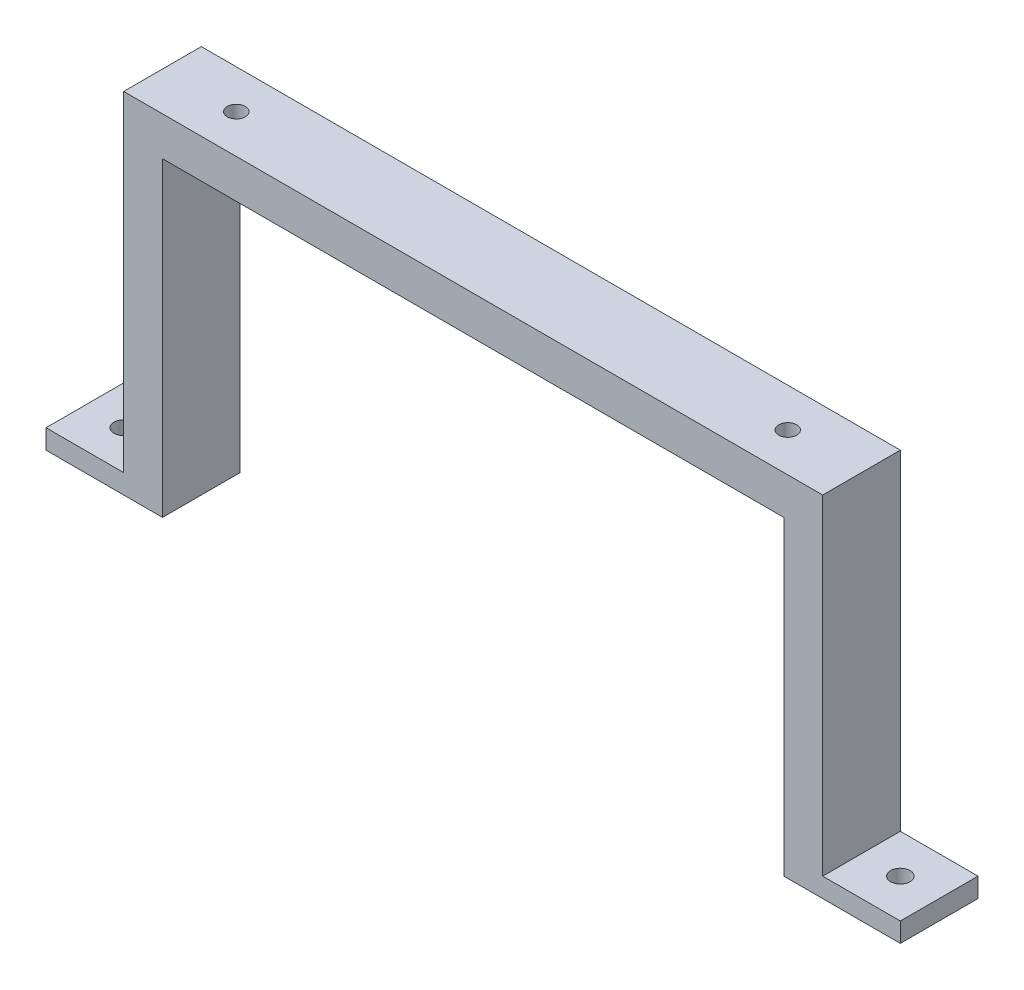
from build123d import *

# Parameters (mm, degrees)
SKETCH1_W           = 114.3
SKETCH1_H           = 12.7
BOSS_EXTRUDE1_DEPTH = 6.35
SKETCH2_W           = 6.35
SKETCH2_H           = 12.7
BOSS_EXTRUDE2_DEPTH = 50.8
SKETCH3_W           = 12.7
SKETCH3_H           = 3.175
BOSS_EXTRUDE3_DEPTH = 12.7
CUT_EXTRUDE1_REACH  = 90.502
SKETCH4_R           = 1.5875
CUT_EXTRUDE2_REACH  = 92.474
SKETCH5_R           = 1.4732


with BuildPart() as part:
    # Sketch1 → Boss-Extrude1 (new body)
    with BuildSketch(Plane(origin=(0, 0, 0), x_dir=(1, 0, 0), z_dir=(0, 1, 0))):
        Rectangle(SKETCH1_W, SKETCH1_H)
    extrude(amount=BOSS_EXTRUDE1_DEPTH)

    # Sketch2 → Boss-Extrude2 (add)
    with BuildSketch(Plane.XZ):
        with Locations((-53.975, 0)):
            Rectangle(SKETCH2_W, SKETCH2_H)
    boss_extrude2 = extrude(amount=BOSS_EXTRUDE2_DEPTH)

    # Sketch3 → Boss-Extrude3 (add)
    with BuildSketch(Plane.ZY.offset(57.15)):
        with Locations((0, -49.2125)):
            Rectangle(SKETCH3_W, SKETCH3_H)
    boss_extrude3 = extrude(amount=BOSS_EXTRUDE3_DEPTH)

    # Mirror1: Boss-Extrude2, Boss-Extrude3 across plane
    add(boss_extrude2.mirror(Plane(origin=(0, 0, 0), x_dir=(0, 0, 1), z_dir=(1, 0, 0))))
    add(boss_extrude3.mirror(Plane(origin=(0, 0, 0), x_dir=(0, 0, 1), z_dir=(1, 0, 0))))

    # Sketch4 → Cut-Extrude1 (cut, up to next)
    with BuildSketch(Plane(origin=(0, -47.625, 0), x_dir=(1, 0, 0), z_dir=(0, 1, 0)), mode=Mode.PRIVATE) as cut_extrude1_sk1:
        with Locations(Location((-63.5, 0, 0), (0, 0, 270))):
            Circle(SKETCH4_R)
    cut_extrude1_tool1 = extrude(cut_extrude1_sk1.sketch, amount=-CUT_EXTRUDE1_REACH, mode=Mode.PRIVATE) & part.part
    cut_extrude1 = cut_extrude1_tool1.solids().sort_by_distance((-63.5, -47.625, 0))[0]
    add(cut_extrude1, mode=Mode.SUBTRACT)

    # Mirror2: Cut-Extrude1 across plane
    add(cut_extrude1.mirror(Plane(origin=(0, 0, 0), x_dir=(0, 0, 1), z_dir=(1, 0, 0))), mode=Mode.SUBTRACT)

    # Sketch5 → Cut-Extrude2 (cut, up to next)
    with BuildSketch(Plane(origin=(0, 6.35, 0), x_dir=(1, 0, 0), z_dir=(0, 1, 0)), mode=Mode.PRIVATE) as cut_extrude2_sk1:
        with Locations(Location((-45.085, 0, 0), (0, 0, 270))):
            Circle(SKETCH5_R)
    cut_extrude2_tool1 = extrude(cut_extrude2_sk1.sketch, amount=-CUT_EXTRUDE2_REACH, mode=Mode.PRIVATE) & part.part
    # Sketch5 → Cut-Extrude2 (cut, up to next)
    with BuildSketch(Plane(origin=(0, 6.35, 0), x_dir=(1, 0, 0), z_dir=(0, 1, 0)), mode=Mode.PRIVATE) as cut_extrude2_sk2:
        with Locations(Location((45.085, 0, 0), (0, 0, 270))):
            Circle(SKETCH5_R)
    cut_extrude2_tool2 = extrude(cut_extrude2_sk2.sketch, amount=-CUT_EXTRUDE2_REACH, mode=Mode.PRIVATE) & part.part
    add(cut_extrude2_tool1.solids().sort_by_distance((-45.085, 6.35, 0))[0], mode=Mode.SUBTRACT)
    add(cut_extrude2_tool2.solids().sort_by_distance((45.085, 6.35, 0))[0], mode=Mode.SUBTRACT)


solid = part.part
